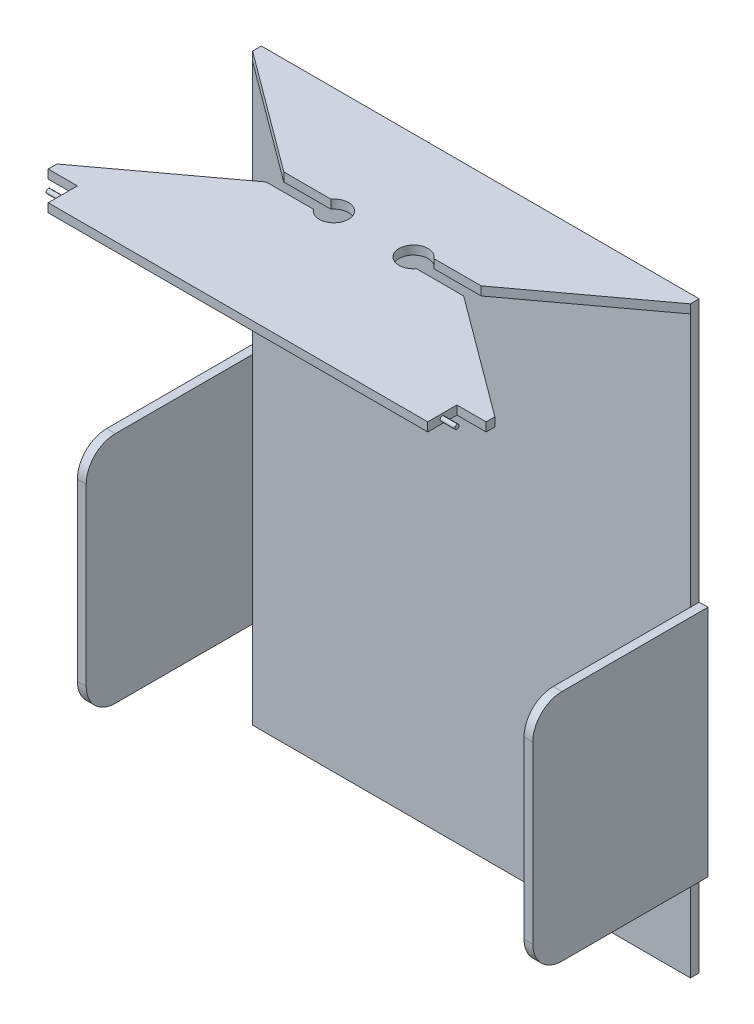
from build123d import *

# Parameters (mm, degrees)
ESQUISSE1_W             = 150
ESQUISSE1_H             = 200
BOSS_EXTRU_1_DEPTH      = 3
ESQUISSE2_W             = 150
ESQUISSE2_H             = 3
BOSS_EXTRU_2_DEPTH      = 80
ESQUISSE3_W             = 10
ESQUISSE3_H             = 10
ENL_V_MAT_EXTRU_1_DEPTH = 80
ESQUISSE4_R             = 0.75
BOSS_EXTRU_3_DEPTH      = 5
BOSS_EXTRU_5_START      = 5
ESQUISSE6_R             = 0.75
BOSS_EXTRU_5_DEPTH      = 5
ENL_V_MAT_EXTRU_2_DEPTH = 3
ESQUISSE10_W            = 60
ESQUISSE10_H            = 80
BOSS_EXTRU_9_DEPTH      = 3
ESQUISSE11_W            = 60
ESQUISSE11_H            = 80
BOSS_EXTRU_10_DEPTH     = 3
CONG_1_R                = 10


with BuildPart() as part:
    # Esquisse1 → Boss.-Extru.1 (new body)
    with BuildSketch(Plane.XY):
        with Locations((75, -100)):
            Rectangle(ESQUISSE1_W, ESQUISSE1_H)
    extrude(amount=BOSS_EXTRU_1_DEPTH)

    # Esquisse2 → Boss.-Extru.2 (add)
    with BuildSketch(Plane.XY.offset(3)):
        with Locations((75, -1.5)):
            Rectangle(ESQUISSE2_W, ESQUISSE2_H)
    extrude(amount=BOSS_EXTRU_2_DEPTH)

    # Esquisse3 → Enlèv. mat.-Extru.1 (cut)
    with BuildSketch(Plane(origin=(0, 0, 0), x_dir=(1, 0, 0), z_dir=(0, 1, 0))):
        with Locations((5, -78)):
            Rectangle(ESQUISSE3_W, ESQUISSE3_H)
        with Locations((145, -78)):
            Rectangle(ESQUISSE3_W, ESQUISSE3_H)
    extrude(amount=-ENL_V_MAT_EXTRU_1_DEPTH, mode=Mode.SUBTRACT)

    # Esquisse4 → Boss.-Extru.3 (add)
    with BuildSketch(Plane(origin=(140, 0, 0), x_dir=(0, 0, -1), z_dir=(1, 0, 0))):
        with Locations(Location((-78, -1.5, 0), (0, 0, 180))):
            Circle(ESQUISSE4_R)
    extrude(amount=BOSS_EXTRU_3_DEPTH)

    # Esquisse6 → Boss.-Extru.5 (add)
    with BuildSketch(Plane.ZY.offset(-10).offset(BOSS_EXTRU_5_START)):
        with Locations((78, -1.5)):
            Circle(ESQUISSE6_R)
    extrude(amount=-BOSS_EXTRU_5_DEPTH)

    # Esquisse9 → Enlèv. mat.-Extru.2 (cut)
    with BuildSketch(Plane(origin=(0, 0, 0), x_dir=(1, 0, 0), z_dir=(0, 1, 0))):
        with BuildLine():
            Line((41.1892956, -33.5), (0, -3))
            Line((0, -3), (0, -70))
            Line((0, -70), (41.1892956, -39.5))
            Line((41.1892956, -39.5), (57.361053438, -39.5))
            ThreePointArc((57.361053438, -39.5), (66.361053438, -36.5), (57.361053438, -33.5))
            Line((57.361053438, -33.5), (41.1892956, -33.5))
        make_face()
        with BuildLine():
            Line((150, -70), (150, -3))
            Line((150, -3), (108.8107044, -33.5))
            Line((108.8107044, -33.5), (92.638946562, -33.5))
            ThreePointArc((92.638946562, -33.5), (83.638946562, -36.5), (92.638946562, -39.5))
            Line((92.638946562, -39.5), (108.8107044, -39.5))
            Line((108.8107044, -39.5), (150, -70))
        make_face()
    extrude(amount=-ENL_V_MAT_EXTRU_2_DEPTH, mode=Mode.SUBTRACT)

    # Esquisse10 → Boss.-Extru.9 (add)
    with BuildSketch(Plane.ZY):
        with Locations((30, -130)):
            Rectangle(ESQUISSE10_W, ESQUISSE10_H)
    extrude(amount=BOSS_EXTRU_9_DEPTH)

    # Esquisse11 → Boss.-Extru.10 (add)
    with BuildSketch(Plane(origin=(150, 0, 0), x_dir=(0, 0, -1), z_dir=(1, 0, 0))):
        with Locations((-30, -130)):
            Rectangle(ESQUISSE11_W, ESQUISSE11_H)
    extrude(amount=BOSS_EXTRU_10_DEPTH)

    # Congé1
    cong_1_edges = [part.edges().sort_by_distance(p)[0] for p in [
        (-1.5, -170, 60),
        (-1.5, -90, 60),
        (151.5, -90, 60),
        (151.5, -170, 60),
    ]]
    fillet(cong_1_edges, radius=CONG_1_R)


solid = part.part
